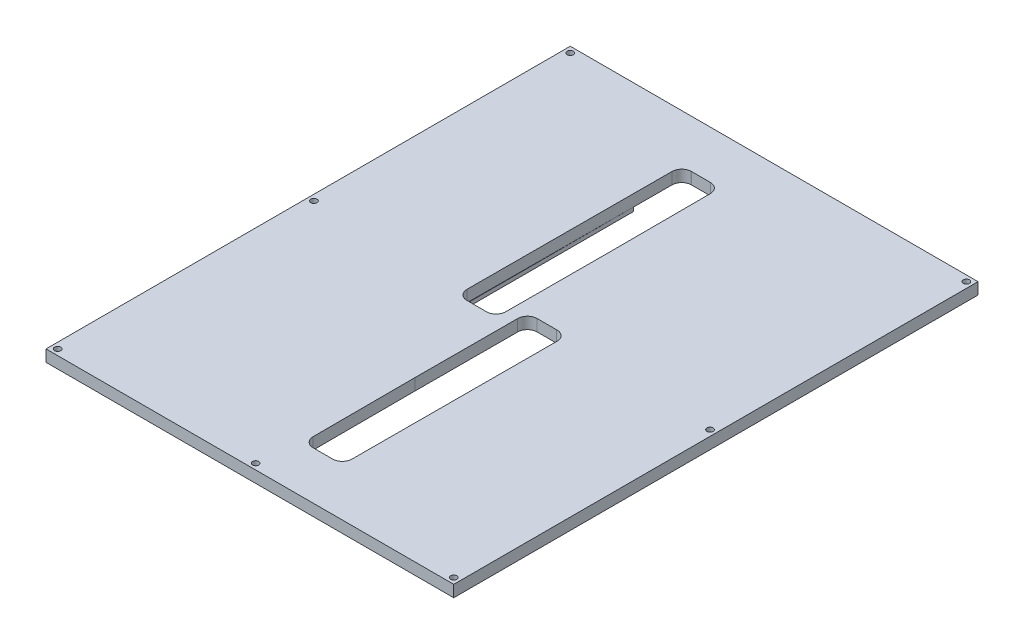
from build123d import *

# Parameters (mm, degrees)
SKETCH1_W           = 210
SKETCH1_H           = 270
BOSS_EXTRUDE1_DEPTH = 6
BOSS_EXTRUDE2_START = -6
SKETCH2_W           = 10
SKETCH2_H           = 182.647861203
SKETCH2_W_2         = 2.953235851
BOSS_EXTRUDE2_DEPTH = 2
SKETCH3_R           = 1.6
CUT_EXTRUDE1_DEPTH  = 30
CUT_EXTRUDE2_DEPTH  = 10
CUT_EXTRUDE3_DEPTH  = 10


with BuildPart() as part:
    # Sketch1 → Boss-Extrude1 (new body)
    with BuildSketch(Plane(origin=(0, 0, 0), x_dir=(1, 0, 0), z_dir=(0, 1, 0))):
        Rectangle(SKETCH1_W, SKETCH1_H)
        with BuildLine():
            Line((-12.932865781, 105.336093738), (-13.182865781, -0.011865408))
            ThreePointArc((-13.182865781, -0.011865408), (-18.19471711, -4.999985921), (-23.182837623, 0.011865408))
            Line((-23.182837623, 0.011865408), (-22.932837623, 105.359824553))
            ThreePointArc((-22.932837623, 105.359824553), (-17.920986294, 110.347945067), (-12.932865781, 105.336093738))
        make_face(mode=Mode.SUBTRACT)
        with BuildLine():
            Line((12.932865781, -105.312362923), (13.182865781, 0.035596223))
            ThreePointArc((13.182865781, 0.035596223), (18.19471711, 5.023716736), (23.182837623, 0.011865408))
            Line((23.182837623, 0.011865408), (22.932837623, -105.336093738))
            ThreePointArc((22.932837623, -105.336093738), (17.920986294, -110.324214252), (12.932865781, -105.312362923))
        make_face(mode=Mode.SUBTRACT)
    extrude(amount=BOSS_EXTRUDE1_DEPTH)

    # Sketch2 → Boss-Extrude2 (add)
    with BuildSketch(Plane(origin=(0, 6, 0), x_dir=(-1, 0, 0), z_dir=(0, 1, 0)).offset(BOSS_EXTRUDE2_START)):
        with Locations((36.432851702, 5.676069398)):
            Rectangle(SKETCH2_W, SKETCH2_H)
        with Locations((24.456233776, 5.676069398)):
            Rectangle(SKETCH2_W_2, SKETCH2_H)
    boss_extrude2 = extrude(amount=-BOSS_EXTRUDE2_DEPTH)

    # Mirror1: Boss-Extrude2 across plane
    add(boss_extrude2.mirror(Plane(origin=(0, 0, 0), x_dir=(0, 0, 1), z_dir=(1, 0, 0))))

    # Sketch3 → Cut-Extrude1 (cut)
    with BuildSketch(Plane.XZ):
        with Locations(Location((-102, 132, 0), (0, 0, 270))):
            Circle(SKETCH3_R)
        with Locations(Location((0, 132, 0), (0, 0, 270))):
            Circle(SKETCH3_R)
        with Locations(Location((102, 132, 0), (0, 0, 270))):
            Circle(SKETCH3_R)
        with Locations(Location((-102, 0, 0), (0, 0, 270))):
            Circle(SKETCH3_R)
        with Locations(Location((-102, -132, 0), (0, 0, 270))):
            Circle(SKETCH3_R)
        with Locations(Location((102, -132, 0), (0, 0, 270))):
            Circle(SKETCH3_R)
        with Locations(Location((102, 0, 0), (0, 0, 270))):
            Circle(SKETCH3_R)
    extrude(amount=-CUT_EXTRUDE1_DEPTH, mode=Mode.SUBTRACT)

    # Sketch4 → Cut-Extrude2 (cut)
    with BuildSketch(Plane.XZ):
        with BuildLine():
            Line((-8.182851702, 5), (-18.182851702, 5))
            Line((-18.182851702, 5), (-18.051918998, -52.673972533))
            Line((-18.051918998, -52.673972533), (-18.182851702, -110.347945067))
            Line((-18.182851702, -110.347945067), (-8.182851702, -110.347945067))
            ThreePointArc((-8.182851702, -110.347945067), (-4.651515343, -108.887671542), (-3.182865781, -105.359810475))
            Line((-3.182865781, -105.359810475), (-3.05783764, -52.673972533))
            Line((-3.05783764, -52.673972533), (-3.182865781, 0.011865408))
            ThreePointArc((-3.182865781, 0.011865408), (-4.651515343, 3.539726475), (-8.182851702, 5))
        make_face()
    extrude(amount=-CUT_EXTRUDE2_DEPTH, mode=Mode.SUBTRACT)

    # Sketch5 → Cut-Extrude3 (cut)
    with BuildSketch(Plane.XZ):
        with BuildLine():
            Line((7.920986294, -5.023730815), (17.920986294, -5.023730815))
            Line((17.920986294, -5.023730815), (17.790053591, 52.650241718))
            Line((17.790053591, 52.650241718), (17.920986294, 110.324214252))
            Line((17.920986294, 110.324214252), (7.920986294, 110.324214252))
            ThreePointArc((7.920986294, 110.324214252), (4.389649935, 108.863940727), (2.921000373, 105.336079659))
            Line((2.921000373, 105.336079659), (2.795972232, 52.650241718))
            Line((2.795972232, 52.650241718), (2.921000373, -0.035596223))
            ThreePointArc((2.921000373, -0.035596223), (4.389649935, -3.56345729), (7.920986294, -5.023730815))
        make_face()
    extrude(amount=-CUT_EXTRUDE3_DEPTH, mode=Mode.SUBTRACT)


solid = part.part
